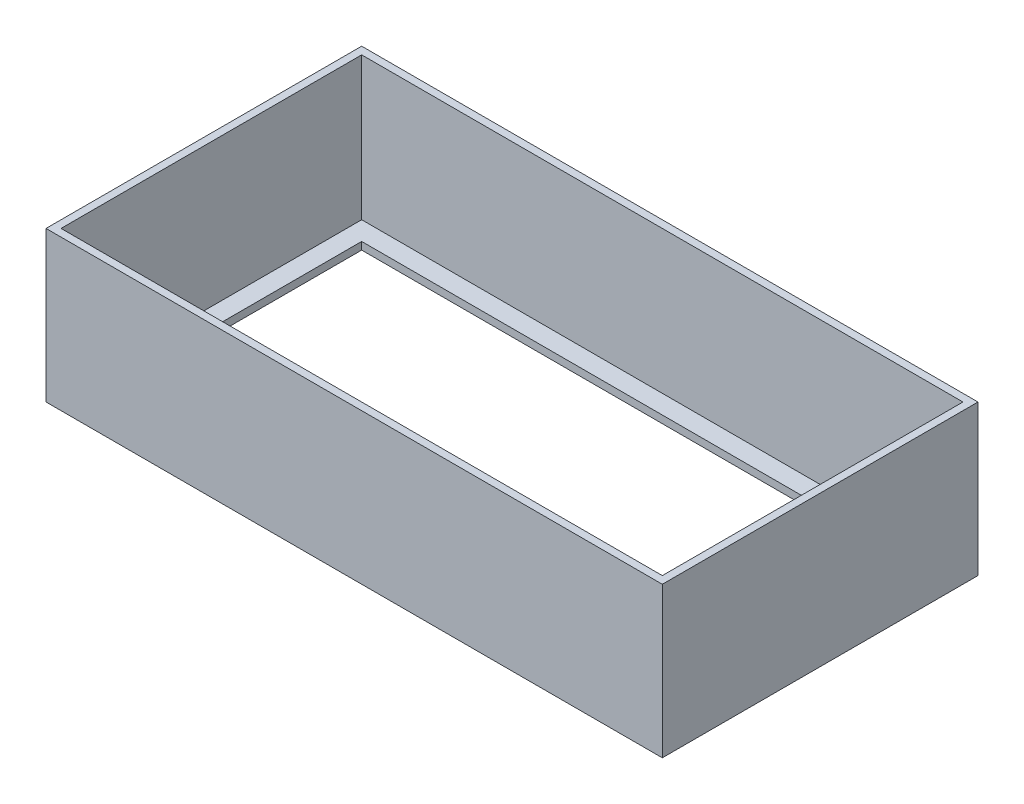
from build123d import *

# Parameters (mm, degrees)
SKETCH1_W           = 164
SKETCH1_H           = 84
BOSS_EXTRUDE1_DEPTH = 40
SHELL1_T            = -2
SKETCH2_W           = 150
SKETCH2_H           = 70
CUT_EXTRUDE1_DEPTH  = 2


with BuildPart() as part:
    # Sketch1 → Boss-Extrude1 (new body)
    with BuildSketch(Plane(origin=(0, 0, 0), x_dir=(1, 0, 0), z_dir=(0, 1, 0))):
        with Locations((82, 42)):
            Rectangle(SKETCH1_W, SKETCH1_H)
    extrude(amount=BOSS_EXTRUDE1_DEPTH)

    # Shell1
    shell1_openings = [part.faces().sort_by_distance(p)[0] for p in [
        (82, 40, -42),
    ]]
    offset(amount=SHELL1_T, openings=shell1_openings, kind=Kind.INTERSECTION)

    # Sketch2 → Cut-Extrude1 (cut)
    with BuildSketch(Plane(origin=(0, 2, 0), x_dir=(1, 0, 0), z_dir=(0, 1, 0))):
        with Locations((82, 42)):
            Rectangle(SKETCH2_W, SKETCH2_H)
    extrude(amount=-CUT_EXTRUDE1_DEPTH, mode=Mode.SUBTRACT)


solid = part.part
